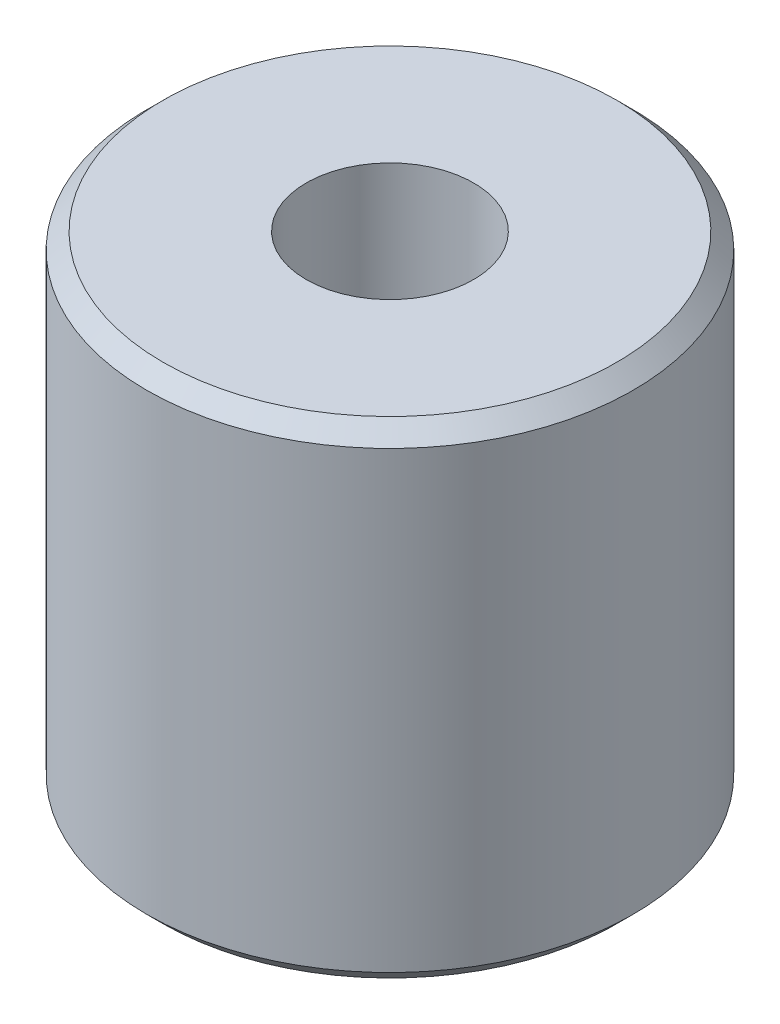
from build123d import *

# Parameters (mm, degrees)
CROQUIS1_R              = 4.5
SALIENTE_EXTRUIR1_DEPTH = 9
CHAFL_N1_SIZE           = 0.3
CHAFL_N2_SIZE           = 0.3
CROQUIS2_R              = 1.55
CORTAR_EXTRUIR1_DEPTH   = 9


with BuildPart() as part:
    # Croquis1 → Saliente-Extruir1 (new body)
    with BuildSketch(Plane(origin=(0, 0, 0), x_dir=(1, 0, 0), z_dir=(0, 1, 0))):
        with Locations(Location((0, 0, 0), (0, 0, 270))):
            Circle(CROQUIS1_R)
    extrude(amount=SALIENTE_EXTRUIR1_DEPTH)

    # Chaflán1
    chafl_n1_edges = [part.edges().sort_by_distance(p)[0] for p in [
        (0, 9, -4.5),
    ]]
    chamfer(chafl_n1_edges, length=CHAFL_N1_SIZE)

    # Chaflán2
    chafl_n2_edges = [part.edges().sort_by_distance(p)[0] for p in [
        (0, 0, -4.5),
    ]]
    chamfer(chafl_n2_edges, length=CHAFL_N2_SIZE)

    # Croquis2 → Cortar-Extruir1 (cut)
    with BuildSketch(Plane(origin=(0, 9, 0), x_dir=(1, 0, 0), z_dir=(0, 1, 0))):
        with Locations(Location((0, 0, 0), (0, 0, 270))):
            Circle(CROQUIS2_R)
    extrude(amount=-CORTAR_EXTRUIR1_DEPTH, mode=Mode.SUBTRACT)


solid = part.part
